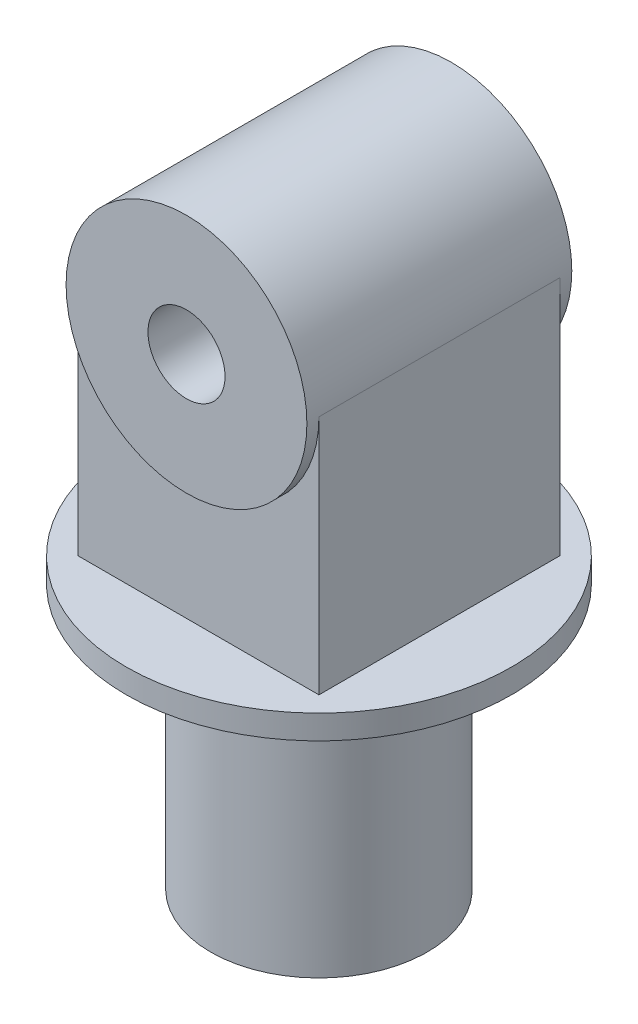
from build123d import *

# Parameters (mm, degrees)
IZIM1_R                     = 22.5
Y_KSEKLIK_EKSTR_ZYON1_DEPTH = 60
Y_KSEKLIK_EKSTR_ZYON2_START = -5
IZIM2_R                     = 40
IZIM2_R_2                   = 22.5
Y_KSEKLIK_EKSTR_ZYON2_DEPTH = 5
IZIM3_W                     = 50
IZIM3_H                     = 50
Y_KSEKLIK_EKSTR_ZYON3_DEPTH = 50
IZIM4_R                     = 25
Y_KSEKLIK_EKSTR_ZYON4_DEPTH = 27.5
IZIM5_R                     = 8
KES_EKSTR_ZYON1_DEPTH       = 157.144964696


with BuildPart() as part:
    # Çizim1 → Yükseklik-Ekstrüzyon1 (new body)
    with BuildSketch(Plane(origin=(0, 0, 0), x_dir=(1, 0, 0), z_dir=(0, 1, 0))):
        with Locations(Location((0, 0, 0), (0, 0, 270))):
            Circle(IZIM1_R)
    extrude(amount=Y_KSEKLIK_EKSTR_ZYON1_DEPTH)

    # Çizim2 → Yükseklik-Ekstrüzyon2 (add)
    with BuildSketch(Plane(origin=(0, 60, 0), x_dir=(1, 0, 0), z_dir=(0, 1, 0)).offset(Y_KSEKLIK_EKSTR_ZYON2_START)):
        with Locations(Location((0, 0, 0), (0, 0, 270))):
            Circle(IZIM2_R)
        with Locations(Location((0, 0, 0), (0, 0, 270))):
            Circle(IZIM2_R_2, mode=Mode.SUBTRACT)
    extrude(amount=Y_KSEKLIK_EKSTR_ZYON2_DEPTH)

    # Çizim3 → Yükseklik-Ekstrüzyon3 (add)
    with BuildSketch(Plane(origin=(0, 60, 0), x_dir=(1, 0, 0), z_dir=(0, 1, 0))):
        Rectangle(IZIM3_W, IZIM3_H)
    extrude(amount=Y_KSEKLIK_EKSTR_ZYON3_DEPTH)

    # Çizim4 → Yükseklik-Ekstrüzyon4 (add, symmetric)
    with BuildSketch(Plane.XY):
        with Locations((0, 110)):
            Circle(IZIM4_R)
    extrude(amount=Y_KSEKLIK_EKSTR_ZYON4_DEPTH, both=True)

    # Çizim5 → Kes-Ekstrüzyon1 (cut, through all)
    with BuildSketch(Plane.XY.offset(27.5)):
        with Locations((0, 110)):
            Circle(IZIM5_R)
    extrude(amount=-KES_EKSTR_ZYON1_DEPTH, mode=Mode.SUBTRACT)


solid = part.part
